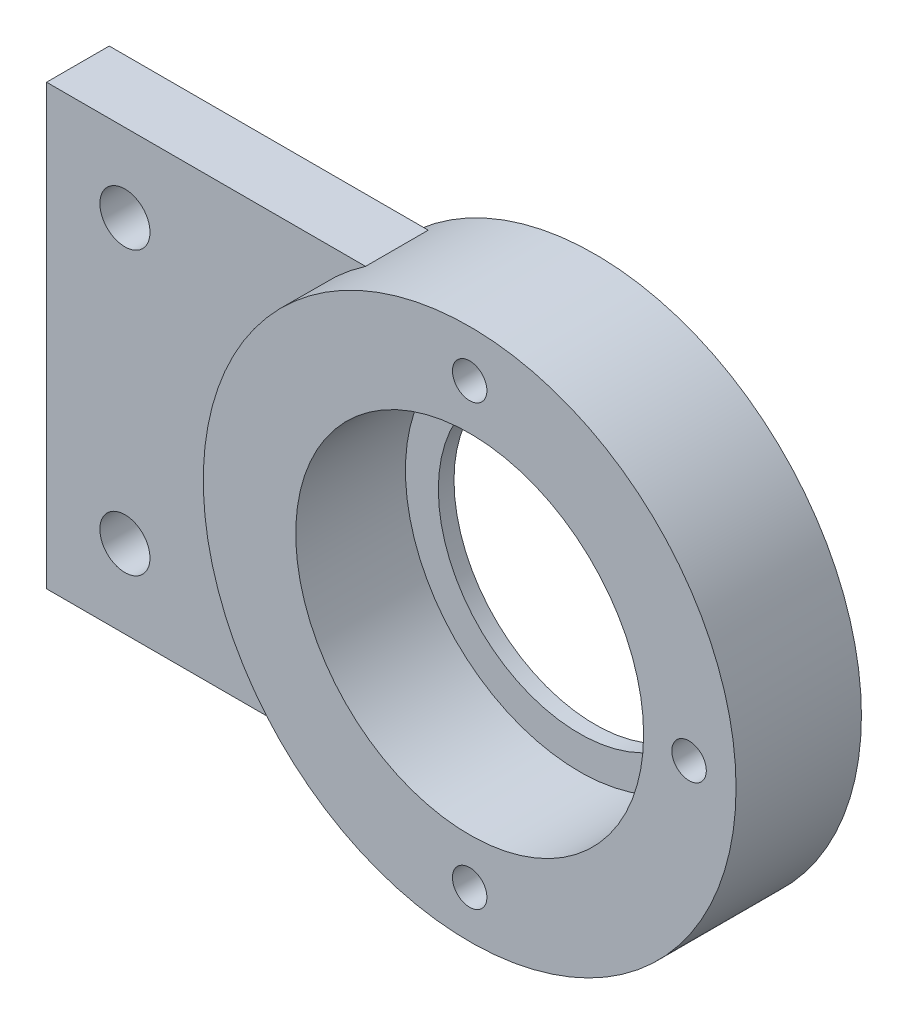
from build123d import *

# Parameters (mm, degrees)
BEARING_HOUSING_PROFILE_R                  = 17
BEARING_HOUSING_PROFILE_R_2                = 11.1
BEARING_HOUSING_DEPTH                      = 7
MOUNTING_WEB_PROFILE_W                     = 30
MOUNTING_WEB_PROFILE_H                     = 28
MOUNTING_WEB_DEPTH                         = 4
BEARING_SEAT_START                         = -50
BEARING_SEAT_PROFILE_R                     = 11.1
BEARING_SEAT_DEPTH                         = 86.185224172
INNER_OUTER_RACE_RETAINING_LIP_START       = -1
INNER_OUTER_RACE_RETAINING_LIP_PROFILE_R   = 17
INNER_OUTER_RACE_RETAINING_LIP_PROFILE_R_2 = 9
INNER_OUTER_RACE_RETAINING_LIP_DEPTH       = 1
STANDOFF_FASTENERS_START                   = -50
STANDOFF_FASTENERS_PROFILE_R               = 1.6
STANDOFF_FASTENERS_DEPTH                   = 86.185224172
BEARING_KEEPER_FASTENERS_START             = -50
BEARING_KEEPER_FASTENERS_PROFILE_R         = 1.1
BEARING_KEEPER_FASTENERS_DEPTH             = 86.185224172


with BuildPart() as part:
    # Bearing_housing_profile → Bearing_housing (new body)
    with BuildSketch(Plane.XY):
        Circle(BEARING_HOUSING_PROFILE_R)
        Circle(BEARING_HOUSING_PROFILE_R_2, mode=Mode.SUBTRACT)
    extrude(amount=BEARING_HOUSING_DEPTH)

    # Mounting_web_profile → Mounting_web (add)
    with BuildSketch(Plane.XY):
        with Locations((-15, 0)):
            Rectangle(MOUNTING_WEB_PROFILE_W, MOUNTING_WEB_PROFILE_H)
    extrude(amount=MOUNTING_WEB_DEPTH)

    # Bearing_seat_profile → Bearing_seat (cut, through all)
    with BuildSketch(Plane.XY.offset(BEARING_SEAT_START)):
        Circle(BEARING_SEAT_PROFILE_R)
    extrude(amount=BEARING_SEAT_DEPTH, mode=Mode.SUBTRACT)

    # Inner_outer_race_retaining_lip_profile → Inner_outer_race_retaining_lip (add)
    with BuildSketch(Plane.XY.offset(INNER_OUTER_RACE_RETAINING_LIP_START)):
        Circle(INNER_OUTER_RACE_RETAINING_LIP_PROFILE_R)
        Circle(INNER_OUTER_RACE_RETAINING_LIP_PROFILE_R_2, mode=Mode.SUBTRACT)
    extrude(amount=INNER_OUTER_RACE_RETAINING_LIP_DEPTH)

    # Standoff_fasteners_profile → Standoff_fasteners (cut, through all)
    with BuildSketch(Plane.XY.offset(STANDOFF_FASTENERS_START)):
        with Locations(Location((-25, -9, 0), (0, 0, 180))):
            Circle(STANDOFF_FASTENERS_PROFILE_R)
        with Locations(Location((-25, 9, 0), (0, 0, 180))):
            Circle(STANDOFF_FASTENERS_PROFILE_R)
    extrude(amount=STANDOFF_FASTENERS_DEPTH, mode=Mode.SUBTRACT)

    # Bearing_keeper_fasteners_profile → Bearing_keeper_fasteners (cut, through all)
    with BuildSketch(Plane.XY.offset(BEARING_KEEPER_FASTENERS_START)):
        with Locations(Location((14, 0, 0), (0, 0, 180))):
            Circle(BEARING_KEEPER_FASTENERS_PROFILE_R)
        with Locations(Location((0, -14, 0), (0, 0, 180))):
            Circle(BEARING_KEEPER_FASTENERS_PROFILE_R)
        with Locations(Location((0, 14, 0), (0, 0, 180))):
            Circle(BEARING_KEEPER_FASTENERS_PROFILE_R)
    extrude(amount=BEARING_KEEPER_FASTENERS_DEPTH, mode=Mode.SUBTRACT)


solid = part.part
